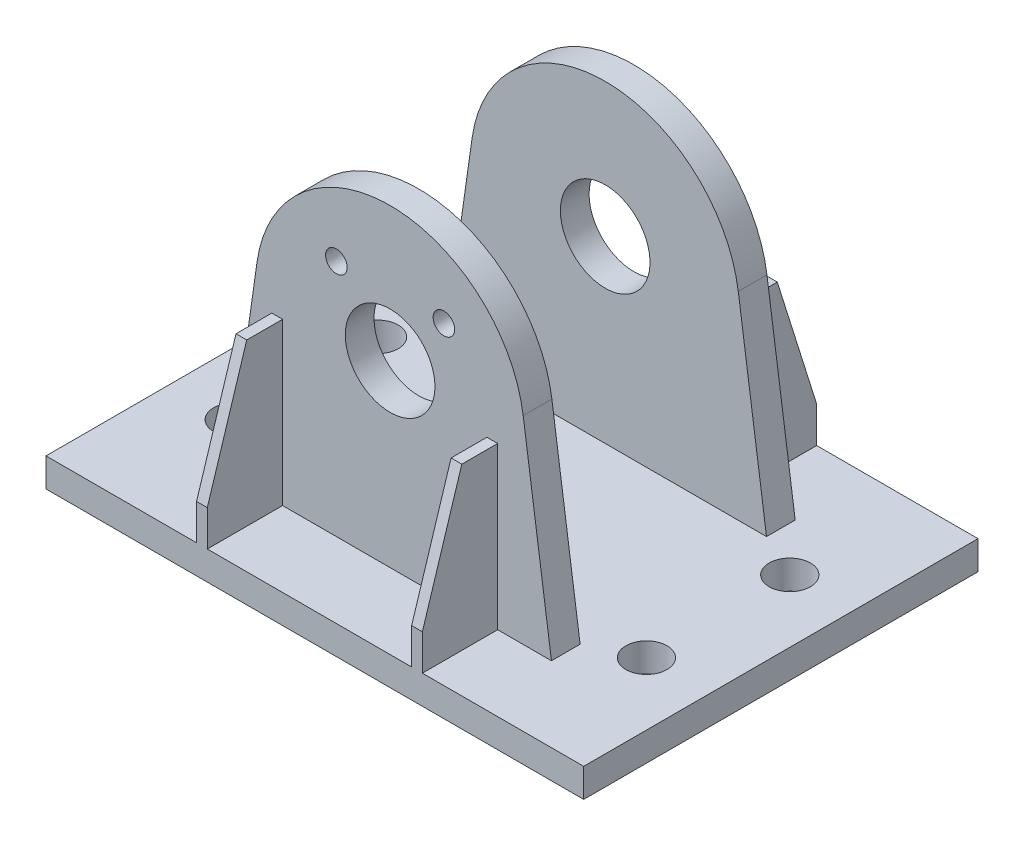
from build123d import *

# Parameters (mm, degrees)
SKETCH_1_W                  = 300
SKETCH_1_H                  = 220
EXTRUDE_1_DEPTH             = 16
SKETCH_2_R                  = 11.5
CUT_EXTRUDE_1_DEPTH         = 373.365411928
PATTERN_LINEAR_1_COUNT      = 2
PATTERN_LINEAR_1_PITCH      = 230
PATTERN_LINEAR_1_COUNT_DIR2 = 2
PATTERN_LINEAR_1_PITCH_DIR2 = 80
SKETCH_3_W                  = 180
SKETCH_3_H                  = 16
EXTRUDE_2_DEPTH             = 175
CUT_EXTRUDE_2_DEPTH         = 398.699635403
CUT_EXTRUDE_3_DEPTH         = 398.699635403
SKETCH_8_R                  = 25
CUT_EXTRUDE_4_DEPTH         = 398.699635403
PATTERN_LINEAR_3_COUNT      = 2
PATTERN_LINEAR_3_PITCH      = 120
SKETCH_9_R                  = 6
CUT_EXTRUDE_5_DEPTH         = 16
PATTERN_LINEAR_4_COUNT      = 2
PATTERN_LINEAR_4_PITCH      = 60
SKETCH_10_W                 = 6
SKETCH_10_H                 = 42
EXTRUDE_3_DEPTH             = 90
PATTERN_LINEAR_5_COUNT      = 2
PATTERN_LINEAR_5_PITCH      = 120
PATTERN_LINEAR_5_COUNT_DIR2 = 2
PATTERN_LINEAR_5_PITCH_DIR2 = 178
CUT_EXTRUDE_6_DEPTH         = 363.680299989


with BuildPart() as part:
    # 草图1 → 凸台-拉伸1 (new body)
    with BuildSketch(Plane(origin=(0, 0, 0), x_dir=(1, 0, 0), z_dir=(0, 1, 0))):
        with Locations((150, 110)):
            Rectangle(SKETCH_1_W, SKETCH_1_H)
    extrude(amount=EXTRUDE_1_DEPTH)

    # 草图2 → 切除-拉伸1 (cut, through all)
    with BuildSketch(Plane(origin=(0, 16, 0), x_dir=(1, 0, 0), z_dir=(0, 1, 0))):
        with Locations(Location((35, 150, 0), (0, 0, 270))):
            Circle(SKETCH_2_R)
    cut_extrude_1 = extrude(amount=-CUT_EXTRUDE_1_DEPTH, mode=Mode.SUBTRACT)

    # 阵列(线性)1: Cut-Extrude 1 2 × 2
    with Locations(*[(i * PATTERN_LINEAR_1_PITCH, 0, j * PATTERN_LINEAR_1_PITCH_DIR2) for i in range(PATTERN_LINEAR_1_COUNT) for j in range(PATTERN_LINEAR_1_COUNT_DIR2) if (i, j) != (0, 0)]):
        add(cut_extrude_1, mode=Mode.SUBTRACT)

    # 草图3 → 凸台-拉伸2 (add)
    with BuildSketch(Plane(origin=(0, 16, 0), x_dir=(1, 0, 0), z_dir=(0, 1, 0))):
        with Locations((150, 170)):
            Rectangle(SKETCH_3_W, SKETCH_3_H)
    extrude_2 = extrude(amount=EXTRUDE_2_DEPTH)

    # 草图5 → 切除-拉伸2 (cut, through all)
    with BuildSketch(Plane(origin=(0, 0, -178), x_dir=(-1, 0, 0), z_dir=(0, 0, -1))):
        with BuildLine():
            Line((-60, 16), (-75.749362078, 126.57557413))
            ThreePointArc((-75.749362078, 126.57557413), (-100.848031879, 172.648777832), (-150, 191))
            Line((-150, 191), (-60, 191))
            Line((-60, 191), (-60, 16))
        make_face()
    cut_extrude_2 = extrude(amount=-CUT_EXTRUDE_2_DEPTH, mode=Mode.SUBTRACT)

    # 草图7 → 切除-拉伸3 (cut, through all)
    with BuildSketch(Plane(origin=(0, 0, -178), x_dir=(-1, 0, 0), z_dir=(0, 0, -1))):
        with BuildLine():
            Line((-224.250637922, 126.57557413), (-240, 16))
            Line((-240, 16), (-240, 191))
            Line((-240, 191), (-150, 191))
            ThreePointArc((-150, 191), (-199.151968121, 172.648777832), (-224.250637922, 126.57557413))
        make_face()
    cut_extrude_3 = extrude(amount=-CUT_EXTRUDE_3_DEPTH, mode=Mode.SUBTRACT)

    # 草图8 → 切除-拉伸4 (cut, through all)
    with BuildSketch(Plane(origin=(0, 0, -178), x_dir=(-1, 0, 0), z_dir=(0, 0, -1))):
        with Locations((-150, 116)):
            Circle(SKETCH_8_R)
    cut_extrude_4 = extrude(amount=-CUT_EXTRUDE_4_DEPTH, mode=Mode.SUBTRACT)

    # 阵列(线性)3: 凸台-拉伸2, 切除-拉伸2, 切除-拉伸3, 切除-拉伸4 ×2
    with Locations(*[(0, 0, i * PATTERN_LINEAR_3_PITCH) for i in range(1, PATTERN_LINEAR_3_COUNT)]):
        add(extrude_2)
        add(cut_extrude_2, mode=Mode.SUBTRACT)
        add(cut_extrude_3, mode=Mode.SUBTRACT)
        add(cut_extrude_4, mode=Mode.SUBTRACT)

    # 草图9 → 切除-拉伸5 (cut)
    with BuildSketch(Plane.XY.offset(-42)):
        with Locations((120, 149)):
            Circle(SKETCH_9_R)
    cut_extrude_5 = extrude(amount=-CUT_EXTRUDE_5_DEPTH, mode=Mode.SUBTRACT)

    # 阵列(线性)4: 切除-拉伸5 ×2
    with Locations(*[(i * PATTERN_LINEAR_4_PITCH, 0, 0) for i in range(1, PATTERN_LINEAR_4_COUNT)]):
        add(cut_extrude_5, mode=Mode.SUBTRACT)

    # 草图10 → 凸台-拉伸3 (add)
    with BuildSketch(Plane(origin=(0, 16, 0), x_dir=(1, 0, 0), z_dir=(0, 1, 0))):
        with Locations((87, 21)):
            Rectangle(SKETCH_10_W, SKETCH_10_H)
    extrude_3 = extrude(amount=EXTRUDE_3_DEPTH)

    # 阵列(线性)5: Extrude 3 2 × 2
    with Locations(*[(i * PATTERN_LINEAR_5_PITCH, 0, -j * PATTERN_LINEAR_5_PITCH_DIR2) for i in range(PATTERN_LINEAR_5_COUNT) for j in range(PATTERN_LINEAR_5_COUNT_DIR2) if (i, j) != (0, 0)]):
        add(extrude_3)

    # 草图11 → 切除-拉伸6 (cut, through all)
    with BuildSketch(Plane.ZY.offset(-84)):
        Polygon((0, 106), (-22, 106), (0, 36), align=None)
        Polygon((-220, 106), (-220, 36), (-198, 106), align=None)
    extrude(amount=-CUT_EXTRUDE_6_DEPTH, mode=Mode.SUBTRACT)


solid = part.part
